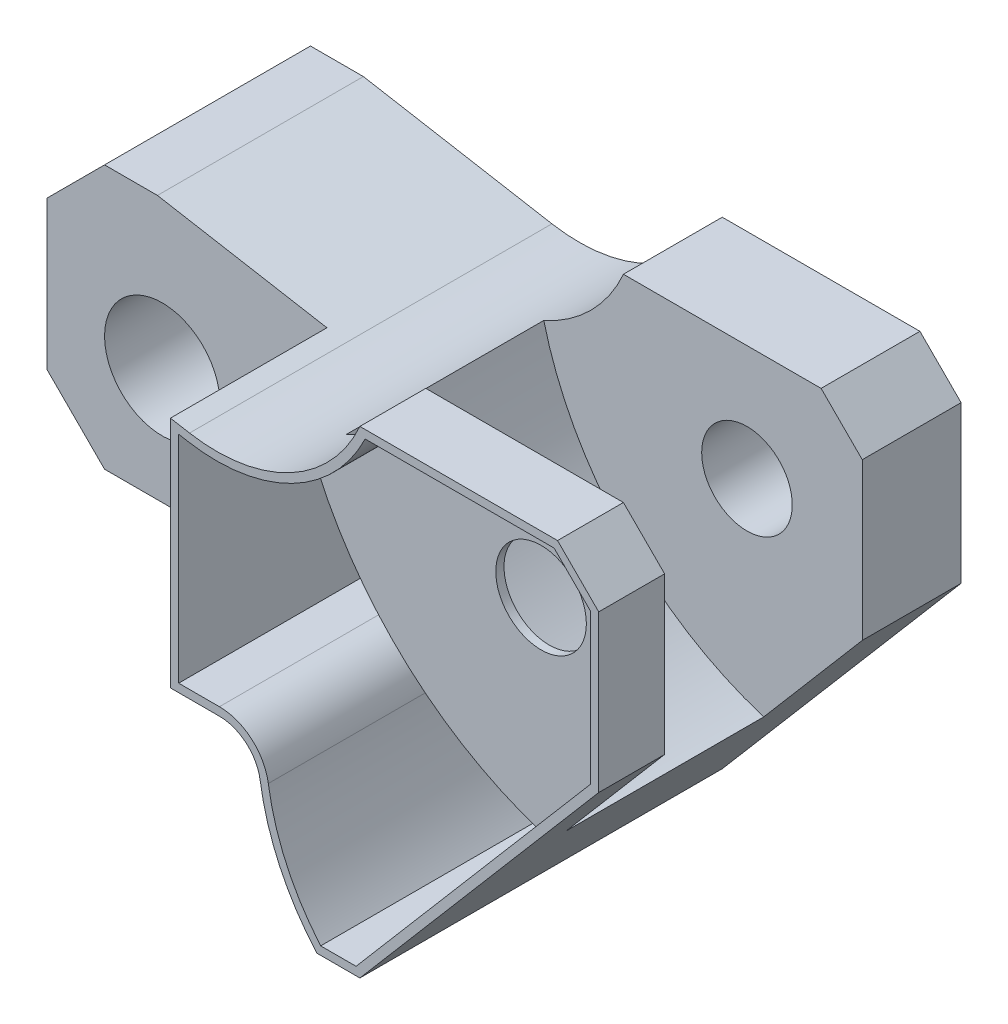
from build123d import *

# Parameters (mm, degrees)
SKETCH1_R           = 7
BOSS_EXTRUDE1_DEPTH = 44
SKETCH70_W          = 24
SKETCH70_H          = 39.86554544
SKETCH71_W          = 34
SKETCH71_H          = 19
CUT_EXTRUDE1_DEPTH  = 43
SKETCH73_R          = 5.5
CUT_EXTRUDE3_DEPTH  = 99.478424033
CUT_EXTRUDE4_DEPTH  = 32
SKETCH78_14_R       = 5.5
CUT_EXTRUDE5_DEPTH  = 7


with BuildPart() as part:
    # Sketch1 → Boss-Extrude1 (new body)
    with BuildSketch(Plane.XY):
        with BuildLine():
            Line((0, 0), (-7, 7))
            Line((-7, 7), (-7, 25))
            Line((-7, 25), (0, 32))
            Line((0, 32), (6.423127039, 32))
            Line((6.423127039, 32), (29.319429923, 27.962764043))
            ThreePointArc((29.319429923, 27.962764043), (41.564716358, 29.911963462), (50, 39))
            Line((50, 39), (74, 39))
            Line((74, 39), (79, 34))
            Line((79, 34), (79, 15))
            Line((79, 15), (50, -19))
            Line((50, -19), (44.788067397, -19))
            ThreePointArc((44.788067397, -19), (40.27095427, -12.128573817), (37.89327269, -4.256633834))
            ThreePointArc((37.89327269, -4.256633834), (36.210984968, -1.21075002), (32.948840798, 0))
            Line((32.948840798, 0), (0, 0))
        make_face()
        with Locations((7, 14)):
            Circle(SKETCH1_R, mode=Mode.SUBTRACT)
    extrude(amount=BOSS_EXTRUDE1_DEPTH)

    # Sketch70 → Cut-Revolve3 (revolve, cut)
    with BuildSketch(Plane(origin=(79, 0, 0), x_dir=(0, 0, -1), z_dir=(1, 0, 0))):
        with Locations((-24, 19.06722728)):
            Rectangle(SKETCH70_W, SKETCH70_H)
    revolve(axis=Axis((79, 39, 36), (0, 0, -1)), mode=Mode.SUBTRACT)

    # Sketch71 → Cut-Extrude1 (cut)
    with BuildSketch(Plane(origin=(0, 39, 0), x_dir=(1, 0, 0), z_dir=(0, 1, 0))):
        with Locations((10, -34.5)):
            Rectangle(SKETCH71_W, SKETCH71_H)
    extrude(amount=-CUT_EXTRUDE1_DEPTH, mode=Mode.SUBTRACT)

    # Sketch73 → Cut-Extrude3 (cut, through all)
    with BuildSketch(Plane.XY):
        with Locations((65, 25)):
            Circle(SKETCH73_R)
    extrude(amount=CUT_EXTRUDE3_DEPTH, mode=Mode.SUBTRACT)

    # Sketch78 → Cut-Extrude4 (cut)
    with BuildSketch(Plane.XY.offset(44)):
        with BuildLine():
            ThreePointArc((36.944123049, 27.147434538), (33.053294732, 26.678832738), (29.145781746, 26.97795629))
            Line((29.145781746, 26.97795629), (28, 27.179988526))
            Line((28, 27.179988526), (28, 1))
            Line((28, 1), (32.948840798, 1))
            ThreePointArc((32.948840798, 1), (36.863413802, -0.452900023), (38.882159069, -4.107960601))
            ThreePointArc((38.882159069, -4.107960601), (41.083042895, -11.502353322), (45.242552598, -18))
            Line((45.242552598, -18), (49.538593943, -18))
            Line((49.538593943, -18), (65.164712554, 0.320276992))
            ThreePointArc((65.164712554, 0.320276992), (47.987855004, 10.508012336), (36.944123049, 27.147434538))
        make_face()
    extrude(amount=-CUT_EXTRUDE4_DEPTH, mode=Mode.SUBTRACT)

    # Sketch78<14> → Cut-Extrude5 (cut)
    with BuildSketch(Plane.XY.offset(44)):
        with BuildLine():
            ThreePointArc((50.639838281, 38), (45.039926113, 30.998835685), (36.944123049, 27.147434538))
            ThreePointArc((36.944123049, 27.147434538), (47.987855004, 10.508012336), (65.164712554, 0.320276992))
            Line((65.164712554, 0.320276992), (78, 15.368545033))
            Line((78, 15.368545033), (78, 33.585786438))
            Line((78, 33.585786438), (73.585786438, 38))
            Line((73.585786438, 38), (50.639838281, 38))
        make_face()
        with Locations((65, 25)):
            Circle(SKETCH78_14_R, mode=Mode.SUBTRACT)
    extrude(amount=-CUT_EXTRUDE5_DEPTH, mode=Mode.SUBTRACT)


solid = part.part
